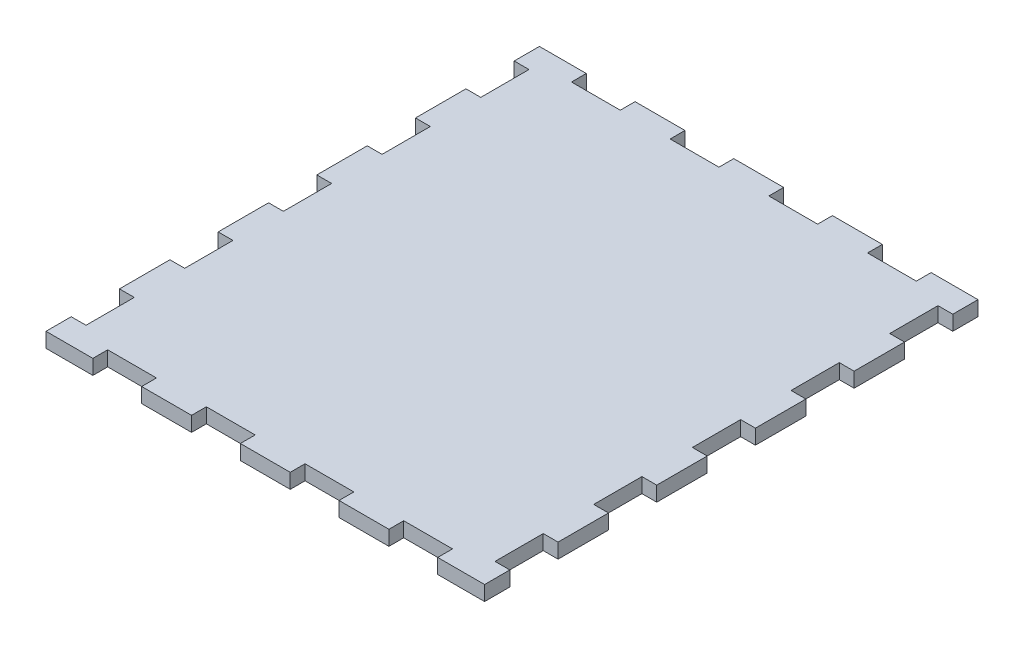
from build123d import *

# Parameters (mm, degrees)
ESQUISSE1_W                    = 80
ESQUISSE1_H                    = 90
BOSS_EXTRU_1_DEPTH             = 2.7
ESQUISSE2_W                    = 2.7
ESQUISSE2_H                    = 8.8
ENL_V_MAT_EXTRU_1_DEPTH        = 2.7
R_P_TITION_LIN_AIRE1_COUNT     = 3
R_P_TITION_LIN_AIRE1_PITCH     = 18
R_P_TITION_LIN_AIRE1_COL_COUNT = 3
R_P_TITION_LIN_AIRE1_COL_PITCH = 18
SYM_TRIE1_COPY_1_SKETCH_W      = 2.7
SYM_TRIE1_COPY_1_SKETCH_H      = 8.8
SYM_TRIE1_COPY_1_DEPTH         = 2.7
SYM_TRIE1_COPY_2_SKETCH_W      = 2.7
SYM_TRIE1_COPY_2_SKETCH_H      = 8.8
SYM_TRIE1_COPY_2_DEPTH         = 2.7
SYM_TRIE1_COPY_3_SKETCH_W      = 2.7
SYM_TRIE1_COPY_3_SKETCH_H      = 8.8
SYM_TRIE1_COPY_3_DEPTH         = 2.7
SYM_TRIE1_COPY_4_SKETCH_W      = 2.7
SYM_TRIE1_COPY_4_SKETCH_H      = 8.8
SYM_TRIE1_COPY_4_DEPTH         = 2.7
ESQUISSE3_W                    = 8.9
ESQUISSE3_H                    = 2.7
ENL_V_MAT_EXTRU_2_DEPTH        = 2.7
R_P_TITION_LIN_AIRE2_COUNT     = 2
R_P_TITION_LIN_AIRE2_PITCH     = 18
R_P_TITION_LIN_AIRE2_COL_COUNT = 3
R_P_TITION_LIN_AIRE2_COL_PITCH = 18
SYM_TRIE2_COPY_1_SKETCH_W      = 8.9
SYM_TRIE2_COPY_1_SKETCH_H      = 2.7
SYM_TRIE2_COPY_1_DEPTH         = 2.7
SYM_TRIE2_COPY_2_SKETCH_W      = 8.9
SYM_TRIE2_COPY_2_SKETCH_H      = 2.7
SYM_TRIE2_COPY_2_DEPTH         = 2.7
SYM_TRIE2_COPY_3_SKETCH_W      = 8.9
SYM_TRIE2_COPY_3_SKETCH_H      = 2.7
SYM_TRIE2_COPY_3_DEPTH         = 2.7


with BuildPart() as part:
    # Esquisse1 → Boss.-Extru.1 (new body)
    with BuildSketch(Plane(origin=(0, 0, 0), x_dir=(1, 0, 0), z_dir=(0, 1, 0))):
        with Locations((167.279220614, 0)):
            Rectangle(ESQUISSE1_W, ESQUISSE1_H)
    extrude(amount=BOSS_EXTRU_1_DEPTH)

    # Esquisse2 → Enlèv. mat.-Extru.1 (cut)
    with BuildSketch(Plane(origin=(0, 0, 0), x_dir=(1, 0, 0), z_dir=(0, 1, 0))):
        with Locations((205.929220614, 0)):
            Rectangle(ESQUISSE2_W, ESQUISSE2_H)
    enl_v_mat_extru_1 = extrude(amount=ENL_V_MAT_EXTRU_1_DEPTH, mode=Mode.SUBTRACT)

    # Répétition linéaire1: Enlèv. mat.-Extru.1 ×3
    with Locations(*[(0, 0, i * R_P_TITION_LIN_AIRE1_PITCH) for i in range(1, R_P_TITION_LIN_AIRE1_COUNT)]):
        add(enl_v_mat_extru_1, mode=Mode.SUBTRACT)

    # Répétition linéaire1 col: Enlèv. mat.-Extru.1 ×3
    with Locations(*[(0, 0, -i * R_P_TITION_LIN_AIRE1_COL_PITCH) for i in range(1, R_P_TITION_LIN_AIRE1_COL_COUNT)]):
        add(enl_v_mat_extru_1, mode=Mode.SUBTRACT)

    # Symétrie1: Enlèv. mat.-Extru.1 across plane
    add(enl_v_mat_extru_1.mirror(Plane(origin=(167.279220614, 0, 0), x_dir=(0, 0, 1), z_dir=(1, 0, 0))), mode=Mode.SUBTRACT)

    # Symétrie1 copy 1 sketch → Symétrie1 copy 1 (cut)
    with BuildSketch(Plane(origin=(334.558441227, 0, 18), x_dir=(-1, 0, 0), z_dir=(0, 1, 0))):
        with Locations((205.929220614, 0)):
            Rectangle(SYM_TRIE1_COPY_1_SKETCH_W, SYM_TRIE1_COPY_1_SKETCH_H)
    extrude(amount=SYM_TRIE1_COPY_1_DEPTH, mode=Mode.SUBTRACT)

    # Symétrie1 copy 2 sketch → Symétrie1 copy 2 (cut)
    with BuildSketch(Plane(origin=(334.558441227, 0, 36), x_dir=(-1, 0, 0), z_dir=(0, 1, 0))):
        with Locations((205.929220614, 0)):
            Rectangle(SYM_TRIE1_COPY_2_SKETCH_W, SYM_TRIE1_COPY_2_SKETCH_H)
    extrude(amount=SYM_TRIE1_COPY_2_DEPTH, mode=Mode.SUBTRACT)

    # Symétrie1 copy 3 sketch → Symétrie1 copy 3 (cut)
    with BuildSketch(Plane(origin=(334.558441227, 0, -18), x_dir=(-1, 0, 0), z_dir=(0, 1, 0))):
        with Locations((205.929220614, 0)):
            Rectangle(SYM_TRIE1_COPY_3_SKETCH_W, SYM_TRIE1_COPY_3_SKETCH_H)
    extrude(amount=SYM_TRIE1_COPY_3_DEPTH, mode=Mode.SUBTRACT)

    # Symétrie1 copy 4 sketch → Symétrie1 copy 4 (cut)
    with BuildSketch(Plane(origin=(334.558441227, 0, -36), x_dir=(-1, 0, 0), z_dir=(0, 1, 0))):
        with Locations((205.929220614, 0)):
            Rectangle(SYM_TRIE1_COPY_4_SKETCH_W, SYM_TRIE1_COPY_4_SKETCH_H)
    extrude(amount=SYM_TRIE1_COPY_4_DEPTH, mode=Mode.SUBTRACT)

    # Esquisse3 → Enlèv. mat.-Extru.2 (cut)
    with BuildSketch(Plane(origin=(0, 0, 0), x_dir=(1, 0, 0), z_dir=(0, 1, 0))):
        with Locations((176.279220614, 43.65)):
            Rectangle(ESQUISSE3_W, ESQUISSE3_H)
    enl_v_mat_extru_2 = extrude(amount=ENL_V_MAT_EXTRU_2_DEPTH, mode=Mode.SUBTRACT)

    # Répétition linéaire2: Enlèv. mat.-Extru.2 ×2
    with Locations(*[(i * R_P_TITION_LIN_AIRE2_PITCH, 0, 0) for i in range(1, R_P_TITION_LIN_AIRE2_COUNT)]):
        add(enl_v_mat_extru_2, mode=Mode.SUBTRACT)

    # Répétition linéaire2 col: Enlèv. mat.-Extru.2 ×3
    with Locations(*[(-i * R_P_TITION_LIN_AIRE2_COL_PITCH, 0, 0) for i in range(1, R_P_TITION_LIN_AIRE2_COL_COUNT)]):
        add(enl_v_mat_extru_2, mode=Mode.SUBTRACT)

    # Symétrie2: Enlèv. mat.-Extru.2 across plane
    add(enl_v_mat_extru_2.mirror(Plane.XY), mode=Mode.SUBTRACT)

    # Symétrie2 copy 1 sketch → Symétrie2 copy 1 (cut)
    with BuildSketch(Plane(origin=(18, 0, 0), x_dir=(1, 0, 0), z_dir=(0, 1, 0))):
        with Locations((176.279220614, -43.65)):
            Rectangle(SYM_TRIE2_COPY_1_SKETCH_W, SYM_TRIE2_COPY_1_SKETCH_H)
    extrude(amount=SYM_TRIE2_COPY_1_DEPTH, mode=Mode.SUBTRACT)

    # Symétrie2 copy 2 sketch → Symétrie2 copy 2 (cut)
    with BuildSketch(Plane(origin=(-18, 0, 0), x_dir=(1, 0, 0), z_dir=(0, 1, 0))):
        with Locations((176.279220614, -43.65)):
            Rectangle(SYM_TRIE2_COPY_2_SKETCH_W, SYM_TRIE2_COPY_2_SKETCH_H)
    extrude(amount=SYM_TRIE2_COPY_2_DEPTH, mode=Mode.SUBTRACT)

    # Symétrie2 copy 3 sketch → Symétrie2 copy 3 (cut)
    with BuildSketch(Plane(origin=(-36, 0, 0), x_dir=(1, 0, 0), z_dir=(0, 1, 0))):
        with Locations((176.279220614, -43.65)):
            Rectangle(SYM_TRIE2_COPY_3_SKETCH_W, SYM_TRIE2_COPY_3_SKETCH_H)
    extrude(amount=SYM_TRIE2_COPY_3_DEPTH, mode=Mode.SUBTRACT)


solid = part.part
